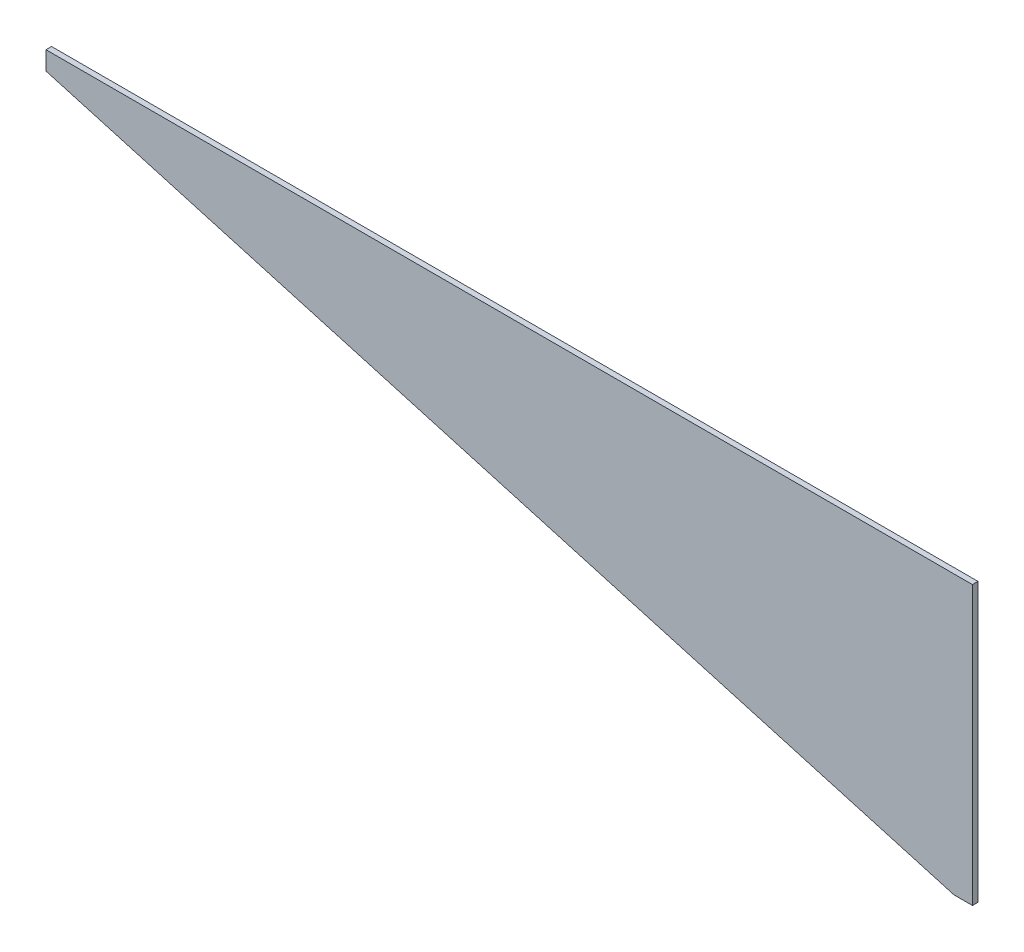
from build123d import *

# Parameters (mm, degrees)
BOSS_EXTRUDE1_DEPTH = 3


with BuildPart() as part:
    # Sketch1 → Boss-Extrude1 (new body)
    with BuildSketch(Plane.XY):
        Polygon((0, 0), (0, 150), (-500, 150), (-500, 140), (-10, 0), align=None)
    extrude(amount=BOSS_EXTRUDE1_DEPTH)


solid = part.part
